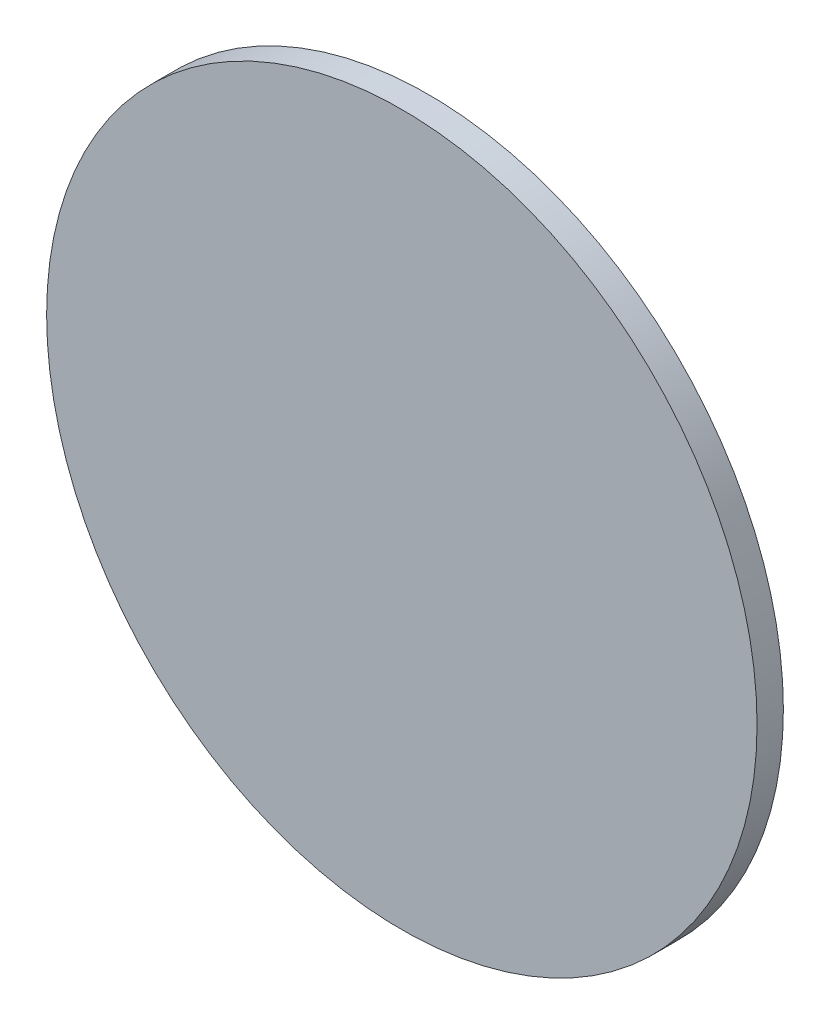
from build123d import *

# Parameters (mm, degrees)
SKETCH1_R           = 13.5
BOSS_EXTRUDE1_DEPTH = 1


with BuildPart() as part:
    # Sketch1 → Boss-Extrude1 (new body)
    with BuildSketch(Plane.XY):
        Circle(SKETCH1_R)
    extrude(amount=BOSS_EXTRUDE1_DEPTH)


solid = part.part
